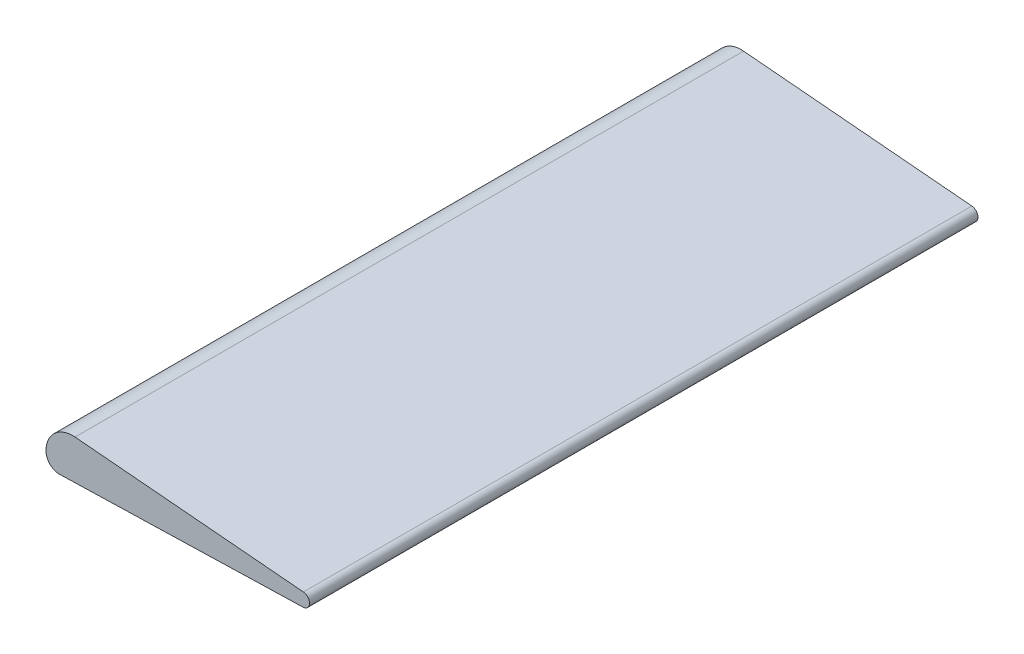
from build123d import *

# Parameters (mm, degrees)
BOSS_EXTRUDE1_DEPTH = 12.7


with BuildPart() as part:
    # Sketch1 → Boss-Extrude1 (new, symmetric)
    with BuildSketch(Plane.XY):
        with BuildLine():
            Line((1.104550235, 1.012133813), (9.781107052, 0.253033453))
            ThreePointArc((9.781107052, 0.253033453), (10.012855938, -0.007594285), (9.765943465, -0.253904241))
            Line((9.765943465, -0.253904241), (0.521947944, -0.507808482))
            ThreePointArc((0.521947944, -0.507808482), (0.15375542, -0.364108195), (0, 0))
            ThreePointArc((0, 0), (0.329600349, 0.749073774), (1.104550235, 1.012133813))
        make_face()
    extrude(amount=BOSS_EXTRUDE1_DEPTH, both=True)


solid = part.part
